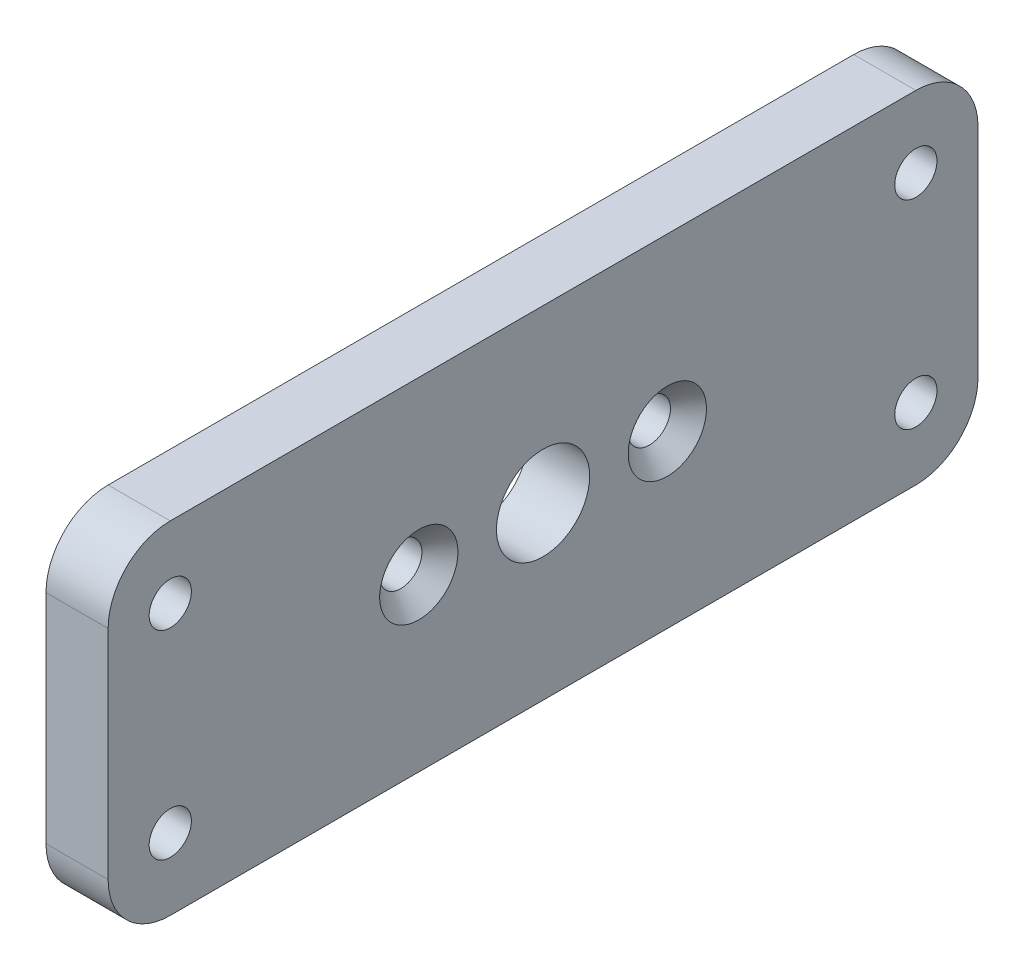
from build123d import *

# Parameters (mm, degrees)
SKETCH1_R                                           = 3.75
BOSS_EXTRUDE1_DEPTH                                 = 5
CSK_FOR_M3_COUNTERSUNK_FLAT_HEAD_SCREW1_D           = 3.4
CSK_FOR_M3_COUNTERSUNK_FLAT_HEAD_SCREW1_CSINK_D     = 6.3
CSK_FOR_M3_COUNTERSUNK_FLAT_HEAD_SCREW1_CSINK_ANGLE = 90
M3_CLEARANCE_HOLE3_D                                = 3.4
M3_CLEARANCE_HOLE3_DEPTH                            = 5
M3_CLEARANCE_HOLE3_TIP                              = 1.021463052


with BuildPart() as part:
    # Sketch1 → Boss-Extrude1 (new body)
    with BuildSketch(Plane(origin=(0, 0, 0), x_dir=(0, 0, -1), z_dir=(1, 0, 0))):
        with BuildLine():
            Line((-30, -13.75), (30, -13.75))
            ThreePointArc((30, -13.75), (33.535533906, -12.285533906), (35, -8.75))
            Line((35, -8.75), (35, 8.75))
            ThreePointArc((35, 8.75), (33.535533906, 12.285533906), (30, 13.75))
            Line((30, 13.75), (-30, 13.75))
            ThreePointArc((-30, 13.75), (-33.535533906, 12.285533906), (-35, 8.75))
            Line((-35, 8.75), (-35, -8.75))
            ThreePointArc((-35, -8.75), (-33.535533906, -12.285533906), (-30, -13.75))
        make_face()
        Circle(SKETCH1_R, mode=Mode.SUBTRACT)
    extrude(amount=BOSS_EXTRUDE1_DEPTH)

    # CSK for M3 Countersunk Flat Head Screw1 (through all)
    with Locations(Plane(origin=(5, 0, 10), x_dir=(0, 0, 1), z_dir=(1, 0, 0))):
        with Locations((0, 0), (-20, 0)):
            CounterSinkHole(CSK_FOR_M3_COUNTERSUNK_FLAT_HEAD_SCREW1_D / 2, CSK_FOR_M3_COUNTERSUNK_FLAT_HEAD_SCREW1_CSINK_D / 2, counter_sink_angle=CSK_FOR_M3_COUNTERSUNK_FLAT_HEAD_SCREW1_CSINK_ANGLE)

    # M3 Clearance Hole3
    with Locations(Plane(origin=(0, 8, 30), x_dir=(0, 0, -1), z_dir=(-1, 0, 0))):
        with Locations((0, 0), (0, 16), (60, 16), (60, 0)):
            Hole(M3_CLEARANCE_HOLE3_D / 2, depth=M3_CLEARANCE_HOLE3_DEPTH)
            with Locations((0, 0, -(M3_CLEARANCE_HOLE3_DEPTH + M3_CLEARANCE_HOLE3_TIP / 2))):  # 118° drill point
                Cone(0, M3_CLEARANCE_HOLE3_D / 2, M3_CLEARANCE_HOLE3_TIP, mode=Mode.SUBTRACT)


solid = part.part
